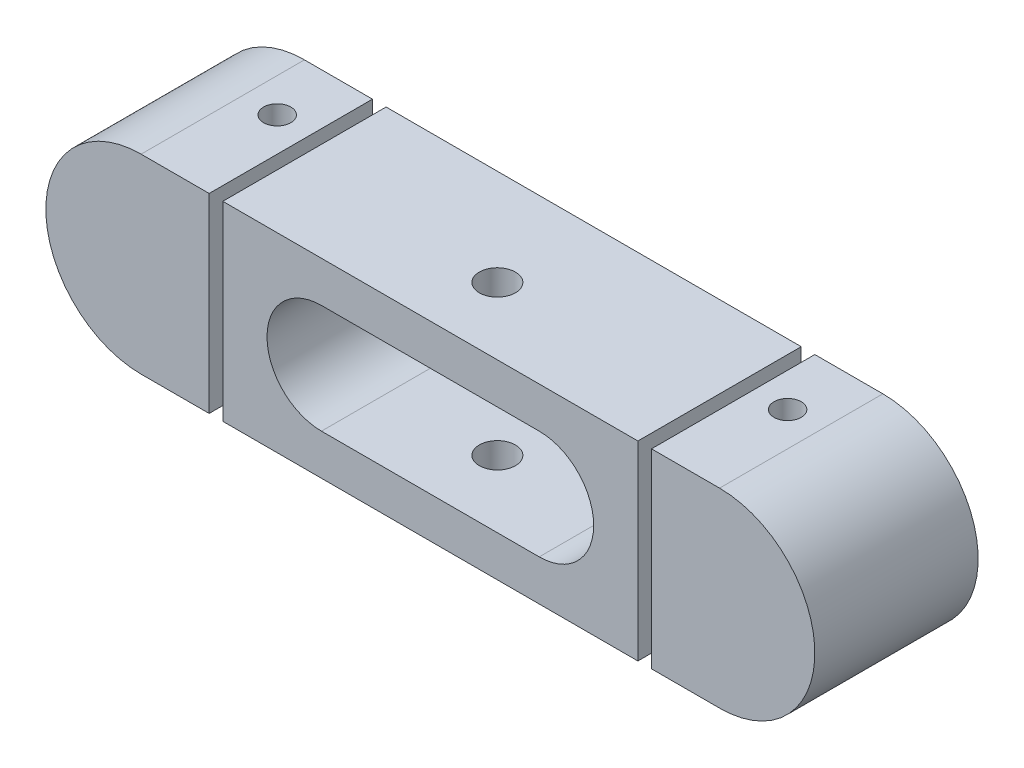
from build123d import *

# Parameters (mm, degrees)
EXTRUDE_1_DEPTH          = 14
EXTRUDE_START            = 10
EXTRUDE_2_DEPTH          = 10
CUT_EXTRUDE_1_DEPTH      = 104.831594421
CUT_EXTRUDE_1_DEPTH_BACK = 104.831594421
SKETCH_3_R               = 2
SKETCH_4_R               = 2.65
CUT_EXTRUDE_2_DEPTH      = 104.831594421
SKETCH_6_W               = 2
SKETCH_6_H               = 24
CUT_EXTRUDE_3_DEPTH      = 2
SKETCH_7_W               = 2
SKETCH_7_H               = 24
CUT_EXTRUDE_4_DEPTH      = 2
SKETCH_8_W               = 2
SKETCH_8_H               = 28
CUT_EXTRUDE_5_DEPTH      = 2
CUT_EXTRUDE_6_DEPTH      = 104.831594421
CUT_EXTRUDE_6_DEPTH_BACK = 104.831594421
SKETCH_9_W               = 2
SKETCH_9_H               = 1
SKETCH_10_W              = 9.2
SKETCH_10_H              = 6.7
CUT_EXTRUDE_7_DEPTH      = 4


with BuildPart() as part:
    # 草图2 → 凸台-拉伸1 (new body)
    with BuildSketch(Plane.XY):
        with BuildLine():
            Line((0, 14), (-85, 14))
            ThreePointArc((-85, 14), (-99, 0), (-85, -14))
            Line((-85, -14), (0, -14))
            ThreePointArc((0, -14), (14, 0), (0, 14))
        make_face()
        Polygon((-84.5, 2.444987437), (-84.5, 3.05), (-84.5, 3.25), (-84.3, 3.25), (-75.7, 3.25), (-75.481671923, 3.25), (-75.3, 3.25), (-75.3, -3.45), (-75.481671923, -3.45), (-84.5, -3.45), (-84.5, -3.05), (-84.5, 0.455012563), align=None, mode=Mode.SUBTRACT)
        with BuildLine():
            ThreePointArc((-26.5, 8), (-18.5, 0), (-26.5, -8))
            Line((-26.5, -8), (-58.5, -8))
            ThreePointArc((-58.5, -8), (-66.5, 0), (-58.5, 8))
            Line((-58.5, 8), (-26.5, 8))
        make_face(mode=Mode.SUBTRACT)
        Polygon((-9.7, -3.45), (-9.7, 3.25), (-9.518328077, 3.25), (-0.5, 3.25), (-0.5, 3.05), (-0.5, -3.45), (-9.518328077, -3.45), align=None, mode=Mode.SUBTRACT)
    extrude(amount=-EXTRUDE_1_DEPTH)

    # 草图2<3> → 凸台-拉伸2 (add)
    with BuildSketch(Plane.XY.offset(EXTRUDE_START)):
        with BuildLine():
            Line((0, 14), (-85, 14))
            ThreePointArc((-85, 14), (-99, 0), (-85, -14))
            Line((-85, -14), (0, -14))
            ThreePointArc((0, -14), (14, 0), (0, 14))
        make_face()
        with BuildLine():
            ThreePointArc((-26.5, 8), (-18.5, 0), (-26.5, -8))
            Line((-26.5, -8), (-58.5, -8))
            ThreePointArc((-58.5, -8), (-66.5, 0), (-58.5, 8))
            Line((-58.5, 8), (-26.5, 8))
        make_face(mode=Mode.SUBTRACT)
    extrude(amount=-EXTRUDE_2_DEPTH)

    # 草图3 → 切除-拉伸1 (cut, two sides: drawn at the far end of the back side and taken through both)
    with BuildSketch(Plane(origin=(0, 14, 0), x_dir=(1, 0, 0), z_dir=(0, 1, 0)).offset(-CUT_EXTRUDE_1_DEPTH_BACK)):
        with Locations((-5, 5)):
            Circle(SKETCH_3_R)
        with Locations((-80, 5)):
            Circle(SKETCH_3_R)
    extrude(amount=CUT_EXTRUDE_1_DEPTH + CUT_EXTRUDE_1_DEPTH_BACK, mode=Mode.SUBTRACT)

    # 草图4 → 切除-拉伸2 (cut, through all)
    with BuildSketch(Plane(origin=(0, 14, 0), x_dir=(1, 0, 0), z_dir=(0, 1, 0))):
        with Locations((-42.5, -0.15)):
            Circle(SKETCH_4_R)
    extrude(amount=-CUT_EXTRUDE_2_DEPTH, mode=Mode.SUBTRACT)

    # 草图6 → 切除-拉伸3 (cut)
    with BuildSketch(Plane(origin=(0, 14, 0), x_dir=(1, 0, 0), z_dir=(0, 1, 0))):
        with Locations((-11, 2)):
            Rectangle(SKETCH_6_W, SKETCH_6_H)
    cut_extrude_3 = extrude(amount=-CUT_EXTRUDE_3_DEPTH, mode=Mode.SUBTRACT)

    # 镜向1: 切除-拉伸3 across plane
    add(cut_extrude_3.mirror(Plane.ZX), mode=Mode.SUBTRACT)

    # 草图7 → 切除-拉伸4 (cut)
    with BuildSketch(Plane(origin=(0, 14, 0), x_dir=(1, 0, 0), z_dir=(0, 1, 0))):
        with Locations((-74, 2)):
            Rectangle(SKETCH_7_W, SKETCH_7_H)
    cut_extrude_4 = extrude(amount=-CUT_EXTRUDE_4_DEPTH, mode=Mode.SUBTRACT)

    # 镜向2: 切除-拉伸4 across plane
    add(cut_extrude_4.mirror(Plane.ZX), mode=Mode.SUBTRACT)

    # 草图8 → 切除-拉伸5 (cut)
    with BuildSketch(Plane.XY.offset(10)):
        with Locations((-11, 0)):
            Rectangle(SKETCH_8_W, SKETCH_8_H)
        with Locations((-74, 0)):
            Rectangle(SKETCH_8_W, SKETCH_8_H)
    extrude(amount=-CUT_EXTRUDE_5_DEPTH, mode=Mode.SUBTRACT)

    # 草图9 → 切除-拉伸6 (cut, two sides: drawn at the far end of the back side and taken through both)
    with BuildSketch(Plane.XZ.offset(14).offset(-CUT_EXTRUDE_6_DEPTH_BACK)):
        with Locations((-74, -13.5)):
            Rectangle(SKETCH_9_W, SKETCH_9_H)
        with Locations((-11, -13.5)):
            Rectangle(SKETCH_9_W, SKETCH_9_H)
    extrude(amount=CUT_EXTRUDE_6_DEPTH + CUT_EXTRUDE_6_DEPTH_BACK, mode=Mode.SUBTRACT)

    # 草图10 → 切除-拉伸7 (cut)
    with BuildSketch(Plane(origin=(0, 0, 0), x_dir=(-1, 0, 0), z_dir=(0, 0, -1))):
        with Locations((79.9, -0.1)):
            Rectangle(SKETCH_10_W, SKETCH_10_H)
        with Locations((5.1, -0.1)):
            Rectangle(SKETCH_10_W, SKETCH_10_H)
    extrude(amount=-CUT_EXTRUDE_7_DEPTH, mode=Mode.SUBTRACT)


solid = part.part
